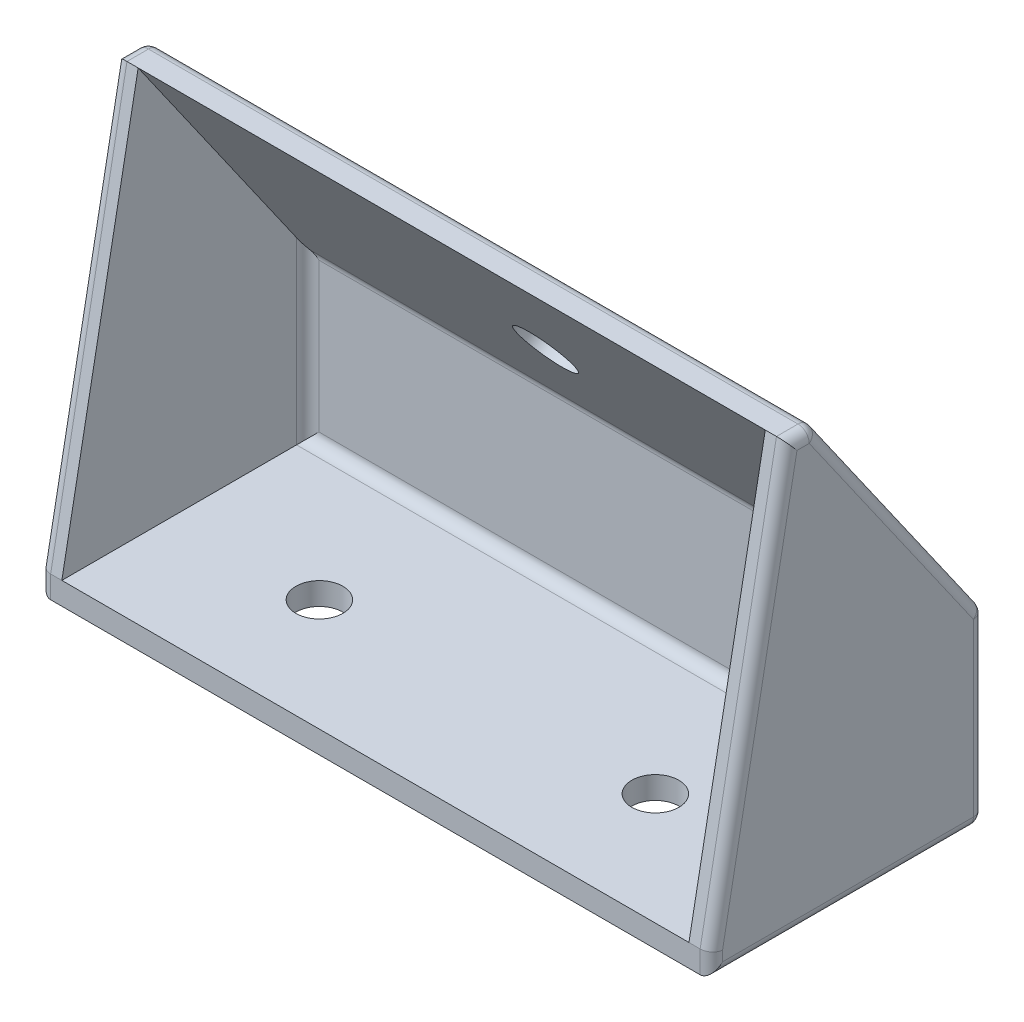
from build123d import *

# Parameters (mm, degrees)
BOSS_EXTRUDE1_DEPTH  = 38.1
SKETCH5_W            = 76.2
SKETCH5_H            = 33.528
BOSS_EXTRUDE2_DEPTH  = 21.082
CUT_EXTRUDE2_DEPTH   = 88.66337421
SKETCH7_R            = 2.667
CUT_EXTRUDE3_DEPTH   = 69.500639142
SKETCH12_R           = 3.25
CUT_EXTRUDE7_DEPTH   = 2.54
SKETCH13_W           = 79.969594391
SKETCH13_H           = 52.20621733
CUT_EXTRUDE8_DEPTH   = 2.54
BOSS_EXTRUDE4_DEPTH  = 2.54
BOSS_EXTRUDE10_DEPTH = 2.54
FILLET8_R            = 1.27


with BuildPart() as part:
    # Sketch1 → Boss-Extrude1 (new, symmetric)
    with BuildSketch(Plane(origin=(0, 0, 0), x_dir=(0, 0, -1), z_dir=(1, 0, 0))):
        Polygon((0, 0), (33.528, 0), (14.297129242, 27.464529741), (0, 27.464529741), align=None)
    extrude(amount=BOSS_EXTRUDE1_DEPTH, both=True)

    # Sketch5 → Boss-Extrude2 (add)
    with BuildSketch(Plane.XZ):
        with Locations((0, -16.764)):
            Rectangle(SKETCH5_W, SKETCH5_H)
    extrude(amount=BOSS_EXTRUDE2_DEPTH)

    # Sketch6 → Cut-Extrude2 (cut, through all)
    with BuildSketch(Plane(origin=(38.1, 0, 0), x_dir=(0, 0, -1), z_dir=(1, 0, 0))):
        Polygon((2.54, 39.827095572), (2.54, -18.542), (30.427232545, -18.542), (30.427232545, 0), align=None)
    extrude(amount=-CUT_EXTRUDE2_DEPTH, mode=Mode.SUBTRACT)

    # Sketch7 → Cut-Extrude3 (cut, through all)
    with BuildSketch(Plane(origin=(0, -18.542, 0), x_dir=(1, 0, 0), z_dir=(0, 1, 0))):
        with Locations(Location((19.05, 15.24, 0), (0, 0, 270))):
            Circle(SKETCH7_R)
        with Locations(Location((-19.05, 15.24, 0), (0, 0, 270))):
            Circle(SKETCH7_R)
    extrude(amount=-CUT_EXTRUDE3_DEPTH, mode=Mode.SUBTRACT)

    # Sketch12 → Cut-Extrude7 (cut)
    with BuildSketch(Plane(origin=(0, 15.753007095, -22.497625683), x_dir=(-1, 0, 0), z_dir=(0, 0.5735764363510444, -0.8191520442889929))):
        with Locations(Location((0, -2.466870758, 0), (0, 0, 90))):
            Circle(SKETCH12_R)
    extrude(amount=-CUT_EXTRUDE7_DEPTH, mode=Mode.SUBTRACT)

    # Sketch13 → Cut-Extrude8 (cut)
    with BuildSketch(Plane.XY):
        with Locations((-0.230592833, 3.838694169)):
            Rectangle(SKETCH13_W, SKETCH13_H)
    extrude(amount=-CUT_EXTRUDE8_DEPTH, mode=Mode.SUBTRACT)

    # Sketch16 → Boss-Extrude4 (add)
    with BuildSketch(Plane(origin=(38.1, 0, 0), x_dir=(0, 0, -1), z_dir=(1, 0, 0))):
        Polygon((2.54, -18.542), (30.427232545, -18.542), (30.427232545, 0), (11.196361787, 27.464529741), align=None)
    extrude(amount=-BOSS_EXTRUDE4_DEPTH)

    # Sketch17 → Boss-Extrude10 (add)
    with BuildSketch(Plane.ZY.offset(38.1)):
        Polygon((-11.196361787, 27.464529741), (-30.427232545, 0), (-30.427232545, -18.542), (-2.54, -18.542), align=None)
    extrude(amount=-BOSS_EXTRUDE10_DEPTH)

    # Fillet8
    fillet8_edges = [part.edges().sort_by_distance(p)[0] for p in [
        (38.1, 13.73226487, -23.912564621),
        (38.1, 27.464529741, -12.746745514),
        (-38.1, -10.541, -33.528),
        (38.1, -10.541, -33.528),
        (0, -21.082, -33.528),
        (38.1, -21.082, -18.034),
        (-38.1, 27.464529741, -12.746745514),
        (-38.1, 13.73226487, -23.912564621),
        (0, 11.070020727, -25.776688039),
        (-38.1, -21.082, -18.034),
        (-38.1, -19.812, -2.54),
        (38.1, -19.812, -2.54),
        (0, 27.464529741, -14.297129242),
        (0, 0, -33.528),
        (35.56, -9.271, -30.427232545),
        (38.1, 4.46126487, -6.868180893),
        (0, -18.542, -30.427232545),
        (0, 0, -30.427232545),
        (-35.56, -9.271, -30.427232545),
        (-38.1, 4.46126487, -6.868180893),
    ]]
    fillet(fillet8_edges, radius=FILLET8_R)


solid = part.part
